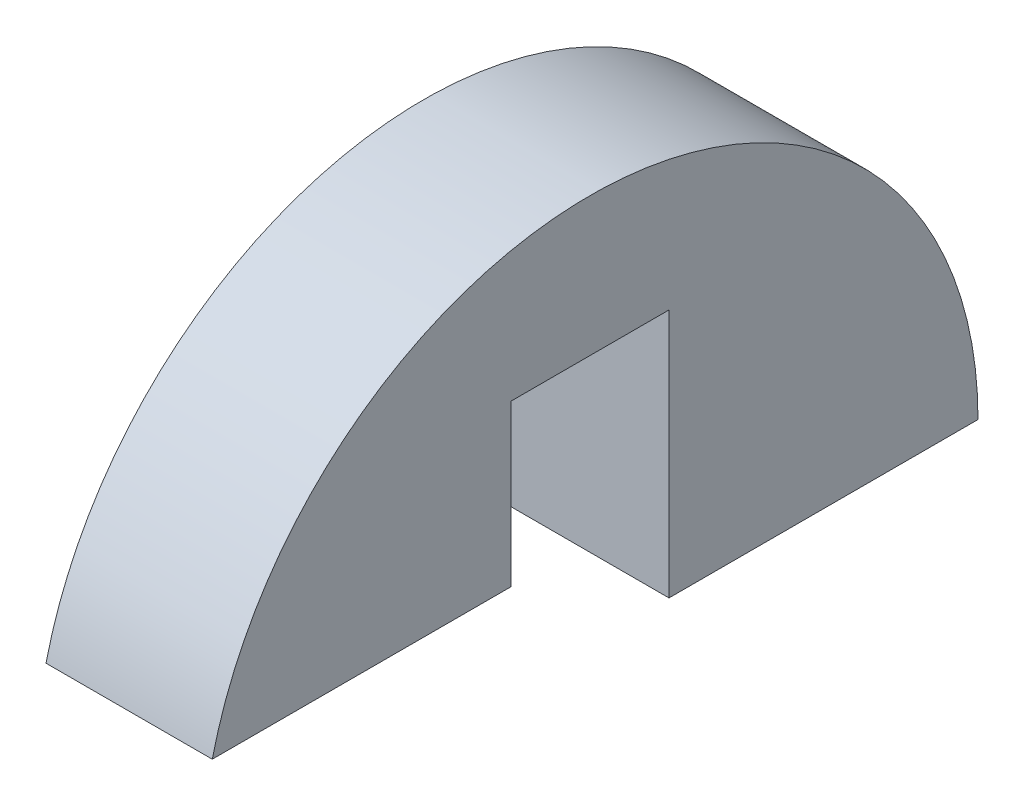
from build123d import *

# Parameters (mm, degrees)
BOSS_EXTRUDE1_DEPTH      = 1.5
BOSS_EXTRUDE1_DEPTH_BACK = 1.5
BODY_MOVE_COPY1_ANGLE    = 90


with BuildPart() as part:
    # Sketch2 → Boss-Extrude1 (new, two sides: drawn at the far end of the back side and taken through both)
    with BuildSketch(Plane(origin=(0, 0, 0), x_dir=(1, 0, 0), z_dir=(0, 1, 0)).offset(-BOSS_EXTRUDE1_DEPTH_BACK)):
        with BuildLine():
            Line((1.6, 1.425), (0, 1.425))
            Line((0, 1.425), (0, 7))
            ThreePointArc((0, 7), (0.805347718, 6.953518178), (1.6, 6.814690015))
            ThreePointArc((1.6, 6.814690015), (7, 0), (1.6, -6.814690015))
            Line((1.6, -6.814690015), (1.6, -1.425))
            Line((1.6, -1.425), (4.5, -1.425))
            Line((4.5, -1.425), (4.5, 1.425))
            Line((4.5, 1.425), (1.6, 1.425))
        make_face()
    extrude(amount=BOSS_EXTRUDE1_DEPTH + BOSS_EXTRUDE1_DEPTH_BACK)


with BuildPart() as part_1:
    # Body-Move/Copy1: moved
    add(part.part.rotate(Axis((0, 0, 0), (0, 0, 1)), BODY_MOVE_COPY1_ANGLE))


solid = part_1.part
